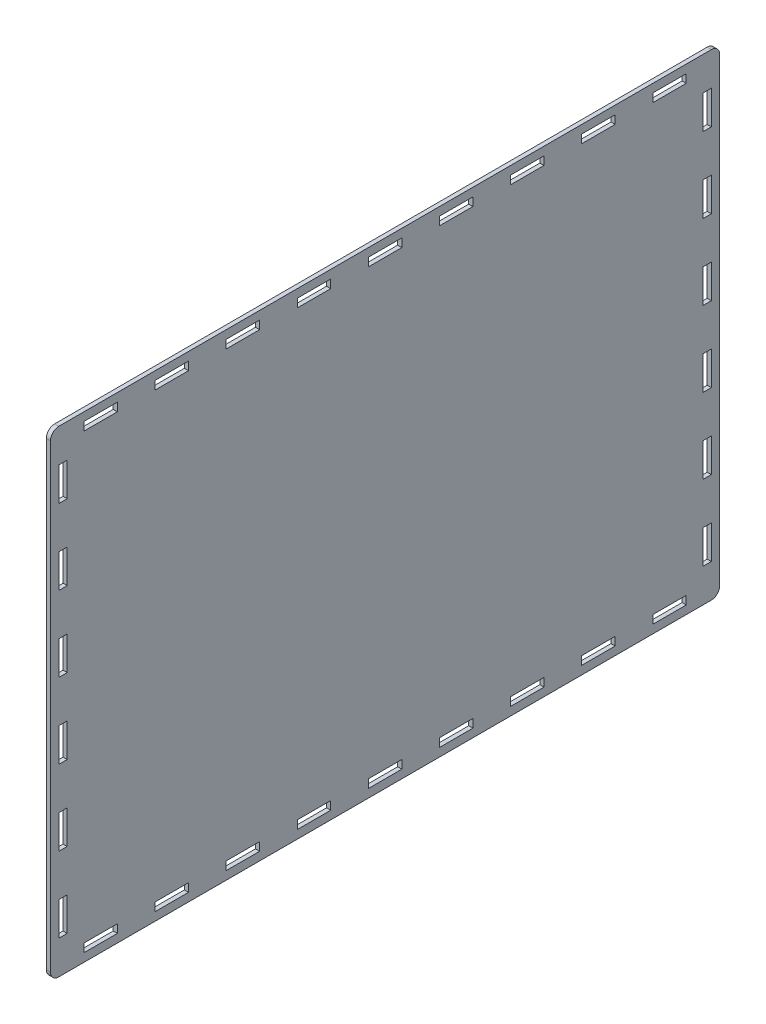
from build123d import *

# Parameters (mm, degrees)
SKETCH1_2_W         = 400
SKETCH1_2_H         = 285
SKETCH1_2_W_2       = 20
SKETCH1_2_H_2       = 5
SKETCH1_2_W_3       = 5
SKETCH1_2_H_3       = 20
BOSS_EXTRUDE3_DEPTH = 2.5
FILLET2_R           = 5


with BuildPart() as part:
    # Sketch1<2> → Boss-Extrude3 (new body)
    with BuildSketch(Plane(origin=(0, 0, 0), x_dir=(0, 0, -1), z_dir=(1, 0, 0))):
        Rectangle(SKETCH1_2_W, SKETCH1_2_H)
        with Locations((-170, -135)):
            Rectangle(SKETCH1_2_W_2, SKETCH1_2_H_2, mode=Mode.SUBTRACT)
        with Locations((-192.5, -112.5)):
            Rectangle(SKETCH1_2_W_3, SKETCH1_2_H_3, mode=Mode.SUBTRACT)
        with Locations((-127.5, -135)):
            Rectangle(SKETCH1_2_W_2, SKETCH1_2_H_2, mode=Mode.SUBTRACT)
        with Locations((-85, -135)):
            Rectangle(SKETCH1_2_W_2, SKETCH1_2_H_2, mode=Mode.SUBTRACT)
        with Locations((-42.5, -135)):
            Rectangle(SKETCH1_2_W_2, SKETCH1_2_H_2, mode=Mode.SUBTRACT)
        with Locations((-192.5, -67.5)):
            Rectangle(SKETCH1_2_W_3, SKETCH1_2_H_3, mode=Mode.SUBTRACT)
        with Locations((-192.5, -22.5)):
            Rectangle(SKETCH1_2_W_3, SKETCH1_2_H_3, mode=Mode.SUBTRACT)
        with Locations((0, -135)):
            Rectangle(SKETCH1_2_W_2, SKETCH1_2_H_2, mode=Mode.SUBTRACT)
        with Locations((42.5, -135)):
            Rectangle(SKETCH1_2_W_2, SKETCH1_2_H_2, mode=Mode.SUBTRACT)
        with Locations((85, -135)):
            Rectangle(SKETCH1_2_W_2, SKETCH1_2_H_2, mode=Mode.SUBTRACT)
        with Locations((127.5, -135)):
            Rectangle(SKETCH1_2_W_2, SKETCH1_2_H_2, mode=Mode.SUBTRACT)
        with Locations((170, -135)):
            Rectangle(SKETCH1_2_W_2, SKETCH1_2_H_2, mode=Mode.SUBTRACT)
        with Locations((192.5, -112.5)):
            Rectangle(SKETCH1_2_W_3, SKETCH1_2_H_3, mode=Mode.SUBTRACT)
        with Locations((192.5, -67.5)):
            Rectangle(SKETCH1_2_W_3, SKETCH1_2_H_3, mode=Mode.SUBTRACT)
        with Locations((192.5, -22.5)):
            Rectangle(SKETCH1_2_W_3, SKETCH1_2_H_3, mode=Mode.SUBTRACT)
        with Locations((-192.5, 22.5)):
            Rectangle(SKETCH1_2_W_3, SKETCH1_2_H_3, mode=Mode.SUBTRACT)
        with Locations((-192.5, 67.5)):
            Rectangle(SKETCH1_2_W_3, SKETCH1_2_H_3, mode=Mode.SUBTRACT)
        with Locations((-192.5, 112.5)):
            Rectangle(SKETCH1_2_W_3, SKETCH1_2_H_3, mode=Mode.SUBTRACT)
        with Locations((-170, 135)):
            Rectangle(SKETCH1_2_W_2, SKETCH1_2_H_2, mode=Mode.SUBTRACT)
        with Locations((-127.5, 135)):
            Rectangle(SKETCH1_2_W_2, SKETCH1_2_H_2, mode=Mode.SUBTRACT)
        with Locations((-85, 135)):
            Rectangle(SKETCH1_2_W_2, SKETCH1_2_H_2, mode=Mode.SUBTRACT)
        with Locations((-42.5, 135)):
            Rectangle(SKETCH1_2_W_2, SKETCH1_2_H_2, mode=Mode.SUBTRACT)
        with Locations((192.5, 22.5)):
            Rectangle(SKETCH1_2_W_3, SKETCH1_2_H_3, mode=Mode.SUBTRACT)
        with Locations((192.5, 67.5)):
            Rectangle(SKETCH1_2_W_3, SKETCH1_2_H_3, mode=Mode.SUBTRACT)
        with Locations((0, 135)):
            Rectangle(SKETCH1_2_W_2, SKETCH1_2_H_2, mode=Mode.SUBTRACT)
        with Locations((42.5, 135)):
            Rectangle(SKETCH1_2_W_2, SKETCH1_2_H_2, mode=Mode.SUBTRACT)
        with Locations((85, 135)):
            Rectangle(SKETCH1_2_W_2, SKETCH1_2_H_2, mode=Mode.SUBTRACT)
        with Locations((127.5, 135)):
            Rectangle(SKETCH1_2_W_2, SKETCH1_2_H_2, mode=Mode.SUBTRACT)
        with Locations((192.5, 112.5)):
            Rectangle(SKETCH1_2_W_3, SKETCH1_2_H_3, mode=Mode.SUBTRACT)
        with Locations((170, 135)):
            Rectangle(SKETCH1_2_W_2, SKETCH1_2_H_2, mode=Mode.SUBTRACT)
    extrude(amount=BOSS_EXTRUDE3_DEPTH)

    # Fillet2
    fillet2_edges = [part.edges().sort_by_distance(p)[0] for p in [
        (1.25, -142.5, 200),
        (1.25, 142.5, -200),
        (1.25, -142.5, -200),
        (1.25, 142.5, 200),
    ]]
    fillet(fillet2_edges, radius=FILLET2_R)


solid = part.part
